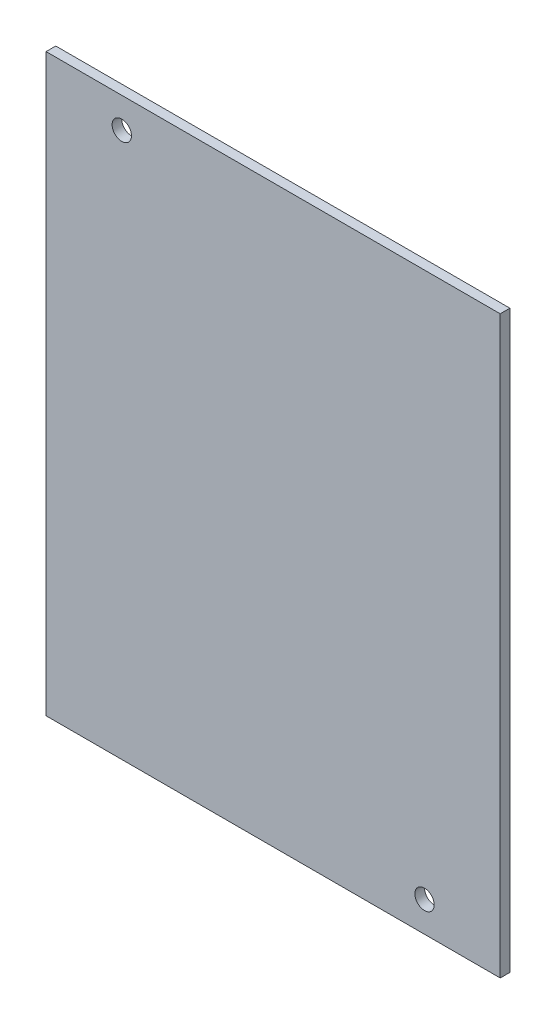
from build123d import *

# Parameters (mm, degrees)
SKETCH1_W           = 75
SKETCH1_H           = 95
SKETCH1_R           = 1.6
BOSS_EXTRUDE1_DEPTH = 1.6


with BuildPart() as part:
    # Sketch1 → Boss-Extrude1 (new body)
    with BuildSketch(Plane.XY):
        with Locations((44.2, -52.900049502)):
            Rectangle(SKETCH1_W, SKETCH1_H)
        with Locations((19.2, -10.400049502)):
            Circle(SKETCH1_R, mode=Mode.SUBTRACT)
        with Locations((69.2, -95.400049502)):
            Circle(SKETCH1_R, mode=Mode.SUBTRACT)
    extrude(amount=BOSS_EXTRUDE1_DEPTH)


solid = part.part
